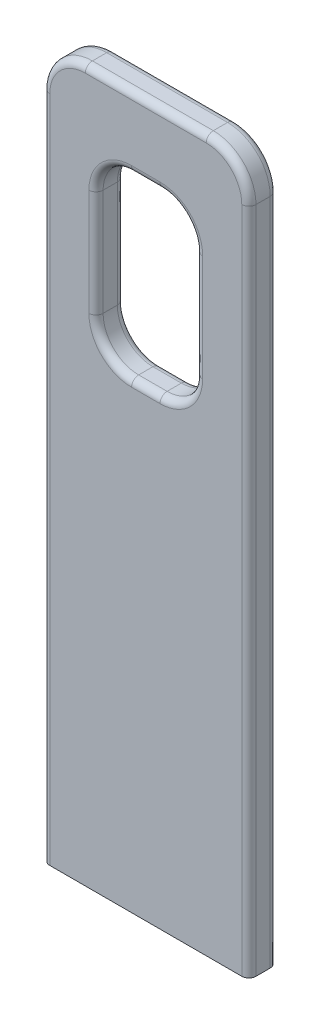
from build123d import *

# Parameters (mm, degrees)
SKETCH1_W      = 2.9
SKETCH1_H      = 10
SKETCH1_W_2    = 1.4
SKETCH1_H_2    = 2.5
EXTRUDE1_DEPTH = 0.2
FILLET1_R      = 0.5
FILLET2_R      = 0.6
FILLET3_R      = 0.1


with BuildPart() as part:
    # Sketch1 → Extrude1 (new, symmetric)
    with BuildSketch(Plane.XY):
        with Locations((0, 5)):
            Rectangle(SKETCH1_W, SKETCH1_H)
        with Locations((0, 7.75)):
            Rectangle(SKETCH1_W_2, SKETCH1_H_2, mode=Mode.SUBTRACT)
    extrude(amount=EXTRUDE1_DEPTH, both=True)

    # Fillet1
    fillet1_edges = [part.edges().sort_by_distance(p)[0] for p in [
        (-0.7, 9, 0),
        (-0.7, 6.5, 0),
        (0.7, 6.5, 0),
        (0.7, 9, 0),
    ]]
    fillet(fillet1_edges, radius=FILLET1_R)

    # Fillet2
    fillet2_edges = [part.edges().sort_by_distance(p)[0] for p in [
        (-1.45, 10, 0),
        (1.45, 10, 0),
    ]]
    fillet(fillet2_edges, radius=FILLET2_R)

    # Fillet3
    fillet3_edges = [part.edges().sort_by_distance(p)[0] for p in [
        (1.45, 4.7, 0.2),
        (0, 6.5, -0.2),
        (0, 6.5, 0.2),
        (0.7, 7.75, -0.2),
        (0.7, 7.75, 0.2),
        (0, 9, -0.2),
        (0, 9, 0.2),
        (-0.7, 7.75, -0.2),
        (-0.7, 7.75, 0.2),
        (0.553553391, 6.646446609, -0.2),
        (0.553553391, 6.646446609, 0.2),
        (0.553553391, 8.853553391, -0.2),
        (0.553553391, 8.853553391, 0.2),
        (-0.553553391, 8.853553391, -0.2),
        (-0.553553391, 8.853553391, 0.2),
        (-0.553553391, 6.646446609, -0.2),
        (-0.553553391, 6.646446609, 0.2),
        (1.45, 4.7, -0.2),
        (0, 10, -0.2),
        (0, 10, 0.2),
        (-1.45, 4.7, -0.2),
        (-1.274264069, 9.824264069, -0.2),
        (1.274264069, 9.824264069, -0.2),
        (-1.45, 4.7, 0.2),
        (-1.274264069, 9.824264069, 0.2),
        (1.274264069, 9.824264069, 0.2),
    ]]
    fillet(fillet3_edges, radius=FILLET3_R)


solid = part.part
